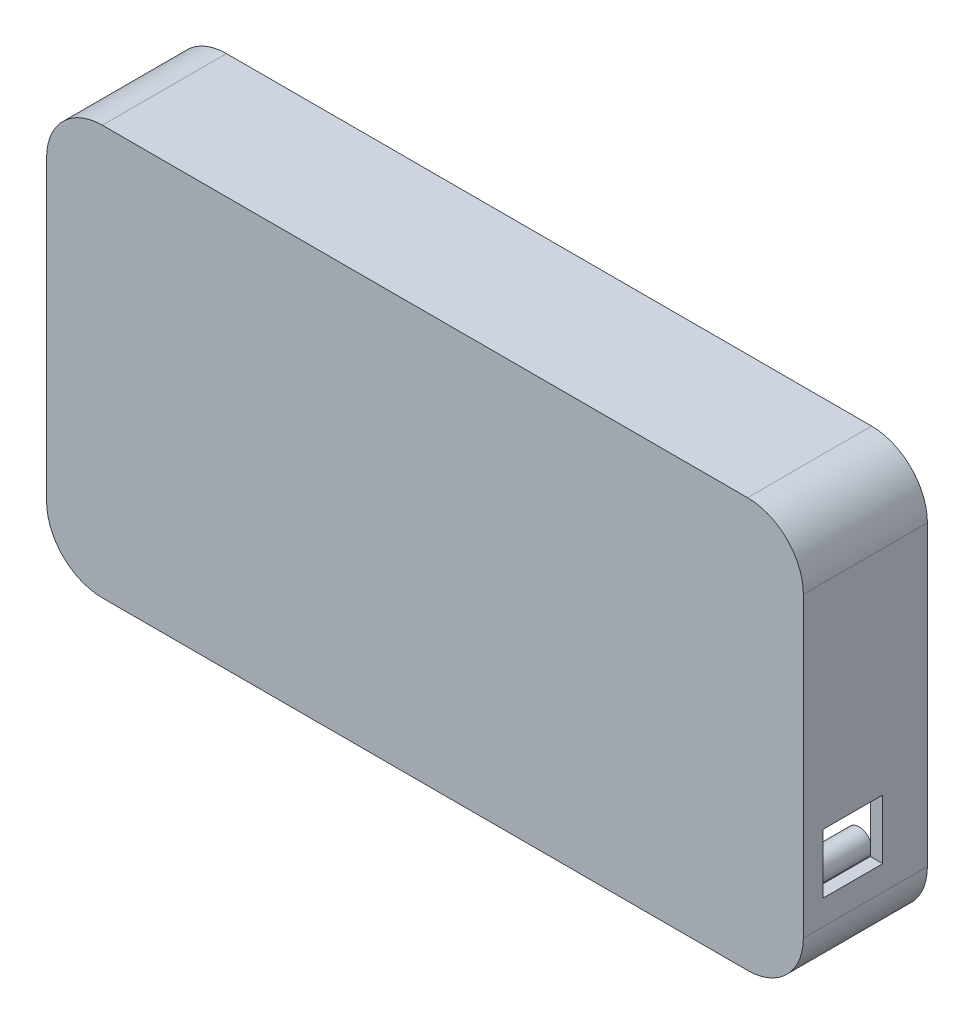
from build123d import *

# Parameters (mm, degrees)
EXTRUDE_1_DEPTH      = 50
SKETCH_1_4_R         = 5.1
CUT_EXTRUDE_1_DEPTH  = 45
CUT_EXTRUDE_2_DEPTH  = 5
SKETCH_1_6_R         = 5.1
CUT_EXTRUDE_3_DEPTH  = 5
SKETCH_1_7_R         = 2.6
CUT_EXTRUDE_4_DEPTH  = 25
SKETCH_14_W          = 14
SKETCH_14_H          = 9
SKETCH_14_R          = 1.6
USB_DEPTH            = 5
SKETCH_16_W          = 24
SKETCH_16_H          = 24
CUT_EXTRUDE_12_DEPTH = 5
SKETCH_18_W          = 24
SKETCH_18_H          = 24
CUT_EXTRUDE_13_DEPTH = 5
EXTRUDE_2_DEPTH      = 40
EXTRUDE_3_DEPTH      = 2
SKETCH_29_4_R        = 2.85
SKETCH_29_4_R_2      = 1.15
EXTRUDE_4_DEPTH      = 5
SKETCH_29_5_R        = 3.4
SKETCH_29_5_R_2      = 1.2
EXTRUDE_5_DEPTH      = 6.5
CUT_EXTRUDE_START    = -2
SKETCH_29_6_R        = 1.15
SKETCH_29_6_R_2      = 1.2
CUT_EXTRUDE_14_DEPTH = 2


with BuildPart() as part:
    # 草图1 → 凸台-拉伸1 (new body)
    with BuildSketch(Plane.XY):
        with BuildLine():
            Line((-130, 82.5), (130, 82.5))
            ThreePointArc((130, 82.5), (145.909902577, 75.909902577), (152.5, 60))
            Line((152.5, 60), (152.5, -60))
            ThreePointArc((152.5, -60), (145.909902577, -75.909902577), (130, -82.5))
            Line((130, -82.5), (-130, -82.5))
            ThreePointArc((-130, -82.5), (-145.909902577, -75.909902577), (-152.5, -60))
            Line((-152.5, -60), (-152.5, 60))
            ThreePointArc((-152.5, 60), (-145.909902577, 75.909902577), (-130, 82.5))
        make_face()
    extrude(amount=EXTRUDE_1_DEPTH)

    # 草图1<4> → 切除-拉伸1 (cut)
    with BuildSketch(Plane.XY):
        with BuildLine():
            Line((130, 77.5), (-130, 77.5))
            ThreePointArc((-130, 77.5), (-142.374368671, 72.374368671), (-147.5, 60))
            Line((-147.5, 60), (-147.5, -60))
            ThreePointArc((-147.5, -60), (-142.374368671, -72.374368671), (-130, -77.5))
            Line((-130, -77.5), (130, -77.5))
            ThreePointArc((130, -77.5), (142.374368671, -72.374368671), (147.5, -60))
            Line((147.5, -60), (147.5, 60))
            ThreePointArc((147.5, 60), (142.374368671, 72.374368671), (130, 77.5))
        make_face()
        with Locations((-130, -60)):
            Circle(SKETCH_1_4_R, mode=Mode.SUBTRACT)
        with Locations((130, -60)):
            Circle(SKETCH_1_4_R, mode=Mode.SUBTRACT)
        with Locations((-130, 60)):
            Circle(SKETCH_1_4_R, mode=Mode.SUBTRACT)
        with Locations((130, 60)):
            Circle(SKETCH_1_4_R, mode=Mode.SUBTRACT)
    extrude(amount=CUT_EXTRUDE_1_DEPTH, mode=Mode.SUBTRACT)

    # 草图1<5> → 切除-拉伸2 (cut)
    with BuildSketch(Plane.XY):
        with BuildLine():
            ThreePointArc((-130, 80.2), (-144.28355698, 74.28355698), (-150.2, 60))
            Line((-150.2, 60), (-150.2, -60))
            ThreePointArc((-150.2, -60), (-144.28355698, -74.28355698), (-130, -80.2))
            Line((-130, -80.2), (130, -80.2))
            ThreePointArc((130, -80.2), (144.28355698, -74.28355698), (150.2, -60))
            Line((150.2, -60), (150.2, 60))
            ThreePointArc((150.2, 60), (144.28355698, 74.28355698), (130, 80.2))
            Line((130, 80.2), (-130, 80.2))
        make_face()
        with BuildLine():
            ThreePointArc((-147.5, 60), (-142.374368671, 72.374368671), (-130, 77.5))
            Line((-130, 77.5), (130, 77.5))
            ThreePointArc((130, 77.5), (142.374368671, 72.374368671), (147.5, 60))
            Line((147.5, 60), (147.5, -60))
            ThreePointArc((147.5, -60), (142.374368671, -72.374368671), (130, -77.5))
            Line((130, -77.5), (-130, -77.5))
            ThreePointArc((-130, -77.5), (-142.374368671, -72.374368671), (-147.5, -60))
            Line((-147.5, -60), (-147.5, 60))
        make_face(mode=Mode.SUBTRACT)
    extrude(amount=CUT_EXTRUDE_2_DEPTH, mode=Mode.SUBTRACT)

    # 草图1<6> → 切除-拉伸3 (cut)
    with BuildSketch(Plane.XY):
        with Locations((130, 60)):
            Circle(SKETCH_1_6_R)
        with Locations((130, -60)):
            Circle(SKETCH_1_6_R)
        with Locations((-130, 60)):
            Circle(SKETCH_1_6_R)
        with Locations((-130, -60)):
            Circle(SKETCH_1_6_R)
    extrude(amount=CUT_EXTRUDE_3_DEPTH, mode=Mode.SUBTRACT)

    # 草图1<7> → 切除-拉伸4 (cut)
    with BuildSketch(Plane.XY):
        with Locations((130, 60)):
            Circle(SKETCH_1_7_R)
        with Locations((130, -60)):
            Circle(SKETCH_1_7_R)
        with Locations((-130, 60)):
            Circle(SKETCH_1_7_R)
        with Locations((-130, -60)):
            Circle(SKETCH_1_7_R)
    extrude(amount=CUT_EXTRUDE_4_DEPTH, mode=Mode.SUBTRACT)

    # 草图14 → USB口 (cut)
    with BuildSketch(Plane.XZ.offset(82.5)):
        with Locations((-80, 38)):
            Rectangle(SKETCH_14_W, SKETCH_14_H)
        with Locations((-70.9, 38)):
            Circle(SKETCH_14_R)
        with Locations((-89.1, 38)):
            Circle(SKETCH_14_R)
    extrude(amount=-USB_DEPTH, mode=Mode.SUBTRACT)

    # 草图16 → 切除-拉伸12 (cut)
    with BuildSketch(Plane(origin=(152.5, 0, 0), x_dir=(0, 0, -1), z_dir=(1, 0, 0))):
        with Locations((-30, -38)):
            Rectangle(SKETCH_16_W, SKETCH_16_H)
    extrude(amount=-CUT_EXTRUDE_12_DEPTH, mode=Mode.SUBTRACT)

    # 草图18 → 切除-拉伸13 (cut)
    with BuildSketch(Plane.ZY.offset(152.5)):
        with Locations((30, -38)):
            Rectangle(SKETCH_18_W, SKETCH_18_H)
    extrude(amount=-CUT_EXTRUDE_13_DEPTH, mode=Mode.SUBTRACT)

    # 草图19 → 凸台-拉伸2 (add)
    with BuildSketch(Plane(origin=(0, 0, 45), x_dir=(-1, 0, 0), z_dir=(0, 0, -1))):
        with BuildLine():
            Line((-103, 40), (-18, 40))
            ThreePointArc((-18, 40), (-14, 36), (-18, 32))
            Line((-18, 32), (-103, 32))
            ThreePointArc((-103, 32), (-107, 36), (-103, 40))
        make_face()
        with BuildLine():
            Line((103, 40), (18, 40))
            ThreePointArc((18, 40), (14, 36), (18, 32))
            Line((18, 32), (103, 32))
            ThreePointArc((103, 32), (107, 36), (103, 40))
        make_face()
        with BuildLine():
            Line((-103, -20), (-23, -20))
            ThreePointArc((-23, -20), (-19, -24), (-23, -28))
            Line((-23, -28), (-103, -28))
            ThreePointArc((-103, -28), (-107, -24), (-103, -20))
        make_face()
        with BuildLine():
            Line((103, -20), (23, -20))
            ThreePointArc((23, -20), (19, -24), (23, -28))
            Line((23, -28), (103, -28))
            ThreePointArc((103, -28), (107, -24), (103, -20))
        make_face()
    extrude(amount=EXTRUDE_2_DEPTH)

    # 草图29 → 凸台-拉伸3 (add)
    with BuildSketch(Plane(origin=(0, 0, 45), x_dir=(-1, 0, 0), z_dir=(0, 0, -1))):
        Polygon((-14.35, -45.2), (14.35, -45.2), (14.35, -18.5), (12.85, -18.5), (12.85, -20), (12.85, -43.7), (-12.85, -43.7), (-12.85, -20), (-12.85, -18.5), (-14.35, -18.5), align=None)
    extrude(amount=EXTRUDE_3_DEPTH)

    # 草图29<4> → 凸台-拉伸4 (add)
    # profile 1 of 2: a face of its own
    with BuildSketch(Plane(origin=(0, 0, 45), x_dir=(-1, 0, 0), z_dir=(0, 0, -1))):
        with Locations((-17.5, -31.85)):
            Circle(SKETCH_29_4_R)
        with Locations((-17.5, -31.85)):
            Circle(SKETCH_29_4_R_2, mode=Mode.SUBTRACT)
    # profile 2 of 2: a face of its own
    with BuildSketch(Plane(origin=(0, 0, 45), x_dir=(-1, 0, 0), z_dir=(0, 0, -1))):
        with Locations((17.5, -31.85)):
            Circle(SKETCH_29_4_R)
        with Locations((17.5, -31.85)):
            Circle(SKETCH_29_4_R_2, mode=Mode.SUBTRACT)
    extrude(amount=EXTRUDE_4_DEPTH)

    # 草图29<5> → 凸台-拉伸5 (add)
    # profile 1 of 4: a face of its own
    with BuildSketch(Plane(origin=(0, 0, 45), x_dir=(-1, 0, 0), z_dir=(0, 0, -1))):
        with Locations((-30, 20)):
            Circle(SKETCH_29_5_R)
        with Locations((-30, 20)):
            Circle(SKETCH_29_5_R_2, mode=Mode.SUBTRACT)
    # profile 2 of 4: a face of its own
    with BuildSketch(Plane(origin=(0, 0, 45), x_dir=(-1, 0, 0), z_dir=(0, 0, -1))):
        with Locations((30, 20)):
            Circle(SKETCH_29_5_R)
        with Locations((30, 20)):
            Circle(SKETCH_29_5_R_2, mode=Mode.SUBTRACT)
    # profile 3 of 4: a face of its own
    with BuildSketch(Plane(origin=(0, 0, 45), x_dir=(-1, 0, 0), z_dir=(0, 0, -1))):
        with Locations((30, -10)):
            Circle(SKETCH_29_5_R)
        with Locations((30, -10)):
            Circle(SKETCH_29_5_R_2, mode=Mode.SUBTRACT)
    # profile 4 of 4: a face of its own
    with BuildSketch(Plane(origin=(0, 0, 45), x_dir=(-1, 0, 0), z_dir=(0, 0, -1))):
        with Locations((-30, -10)):
            Circle(SKETCH_29_5_R)
        with Locations((-30, -10)):
            Circle(SKETCH_29_5_R_2, mode=Mode.SUBTRACT)
    extrude(amount=EXTRUDE_5_DEPTH)

    # 草图29<6> → 切除-拉伸14 (cut)
    with BuildSketch(Plane(origin=(0, 0, 45), x_dir=(-1, 0, 0), z_dir=(0, 0, -1)).offset(CUT_EXTRUDE_START)):
        with Locations((-17.5, -31.85)):
            Circle(SKETCH_29_6_R)
        with Locations((17.5, -31.85)):
            Circle(SKETCH_29_6_R)
        with Locations((-30, 20)):
            Circle(SKETCH_29_6_R_2)
        with Locations((30, 20)):
            Circle(SKETCH_29_6_R_2)
        with Locations((30, -10)):
            Circle(SKETCH_29_6_R_2)
        with Locations((-30, -10)):
            Circle(SKETCH_29_6_R_2)
    extrude(amount=CUT_EXTRUDE_14_DEPTH, mode=Mode.SUBTRACT)


solid = part.part
